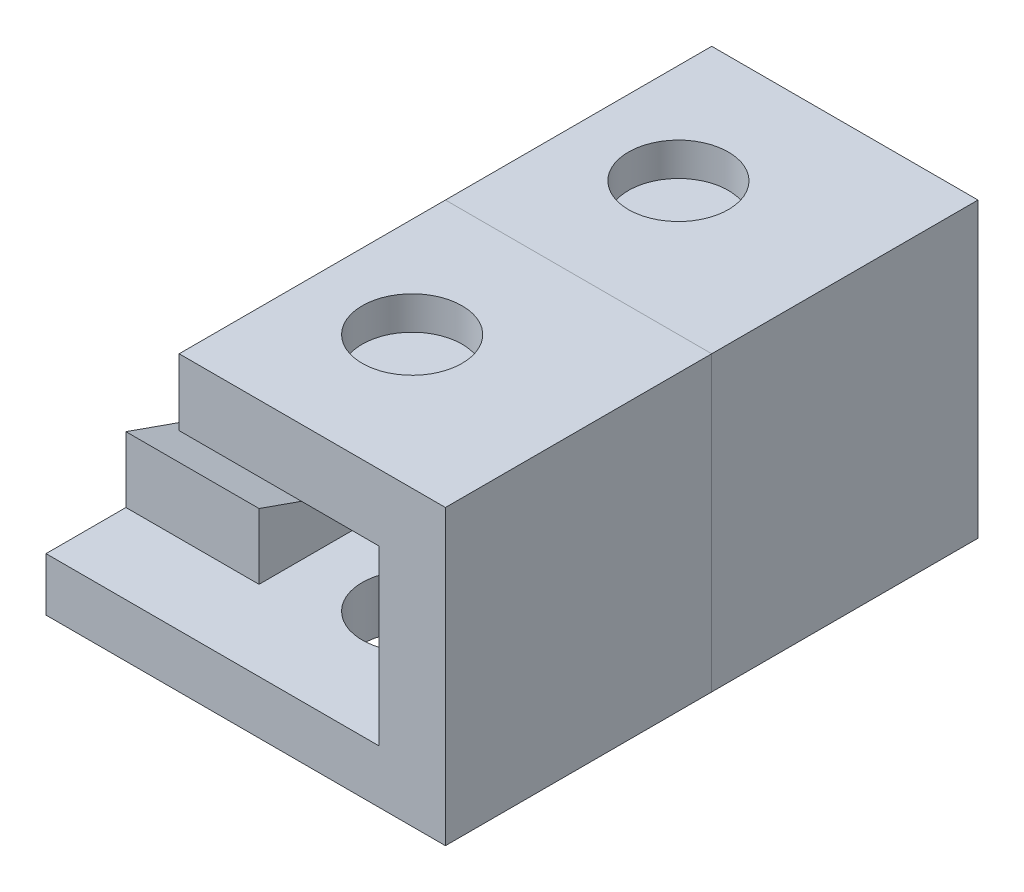
from build123d import *

# Parameters (mm, degrees)
BOSS_EXTRUDE1_DEPTH      = 2.54
BOSS_EXTRUDE1_DEPTH_BACK = 2.54
SKETCH1_W                = 31.75
SKETCH1_H                = 25.4
SKETCH1_R                = 4.7625
SKETCH1_3_W              = 12.7
SKETCH1_3_H              = 17.655412268
BOSS_EXTRUDE2_DEPTH      = 2.54
BOSS_EXTRUDE3_DEPTH      = 25.4
BOSS_EXTRUDE3_DEPTH_BACK = 2.54
SKETCH1_4_W              = 6.35
SKETCH1_4_H              = 25.4
SKETCH2_W                = 25.4
SKETCH2_H                = 6.35
BOSS_EXTRUDE4_DEPTH      = 19.05
CUT_EXTRUDE1_START       = -3.175
SKETCH4_R                = 4.7625
CUT_EXTRUDE1_DEPTH       = 3.175
BOSS_EXTRUDE5_DEPTH      = 12.7


with BuildPart() as part:
    # Sketch1 → Boss-Extrude1 (new, two sides: drawn at the far end of the back side and taken through both)
    with BuildSketch(Plane(origin=(0, 0, 0), x_dir=(1, 0, 0), z_dir=(0, 1, 0)).offset(-BOSS_EXTRUDE1_DEPTH_BACK)):
        with Locations((15.875, 12.7)):
            Rectangle(SKETCH1_W, SKETCH1_H)
        with Locations((22.225, 12.7)):
            Circle(SKETCH1_R, mode=Mode.SUBTRACT)
    extrude(amount=BOSS_EXTRUDE1_DEPTH + BOSS_EXTRUDE1_DEPTH_BACK)

    # Sketch1<3> → Boss-Extrude2 (add)
    with BuildSketch(Plane(origin=(0, 0, 0), x_dir=(1, 0, 0), z_dir=(0, 1, 0))):
        with Locations((6.35, 8.827706134)):
            Rectangle(SKETCH1_3_W, SKETCH1_3_H)
    extrude(amount=BOSS_EXTRUDE2_DEPTH)

    # Sketch1<4> → Boss-Extrude3 (add, two sides: drawn at the far end of the back side and taken through both)
    with BuildSketch(Plane(origin=(0, 0, 0), x_dir=(1, 0, 0), z_dir=(0, 1, 0)).offset(-BOSS_EXTRUDE3_DEPTH_BACK)):
        with Locations((34.925, 12.7)):
            Rectangle(SKETCH1_4_W, SKETCH1_4_H)
    extrude(amount=BOSS_EXTRUDE3_DEPTH + BOSS_EXTRUDE3_DEPTH_BACK)

    # Sketch2 → Boss-Extrude4 (add)
    with BuildSketch(Plane.ZY.offset(-31.75)):
        with Locations((-12.7, 22.225)):
            Rectangle(SKETCH2_W, SKETCH2_H)
    extrude(amount=BOSS_EXTRUDE4_DEPTH)

    # Sketch4 → Cut-Extrude1 (cut)
    with BuildSketch(Plane(origin=(0, 25.4, 0), x_dir=(1, 0, 0), z_dir=(0, 1, 0)).offset(CUT_EXTRUDE1_START)):
        with Locations((22.225, 12.7)):
            Circle(SKETCH4_R)
    extrude(amount=CUT_EXTRUDE1_DEPTH, mode=Mode.SUBTRACT)

    # Sketch16 → Boss-Extrude5 (add)
    with BuildSketch(Plane.ZY):
        Polygon((-17.778601637, 2.54), (-17.778601637, 8.805137728), (0, 2.54), align=None)
    extrude(amount=-BOSS_EXTRUDE5_DEPTH)


with BuildPart() as body_2:
    # Mirror3: mirrored copy
    add(part.part.mirror(Plane(origin=(0, -2.54, 0), x_dir=(1, 0, 0), z_dir=(0, 0, 1))))


solid = Compound([part.part, body_2.part])
